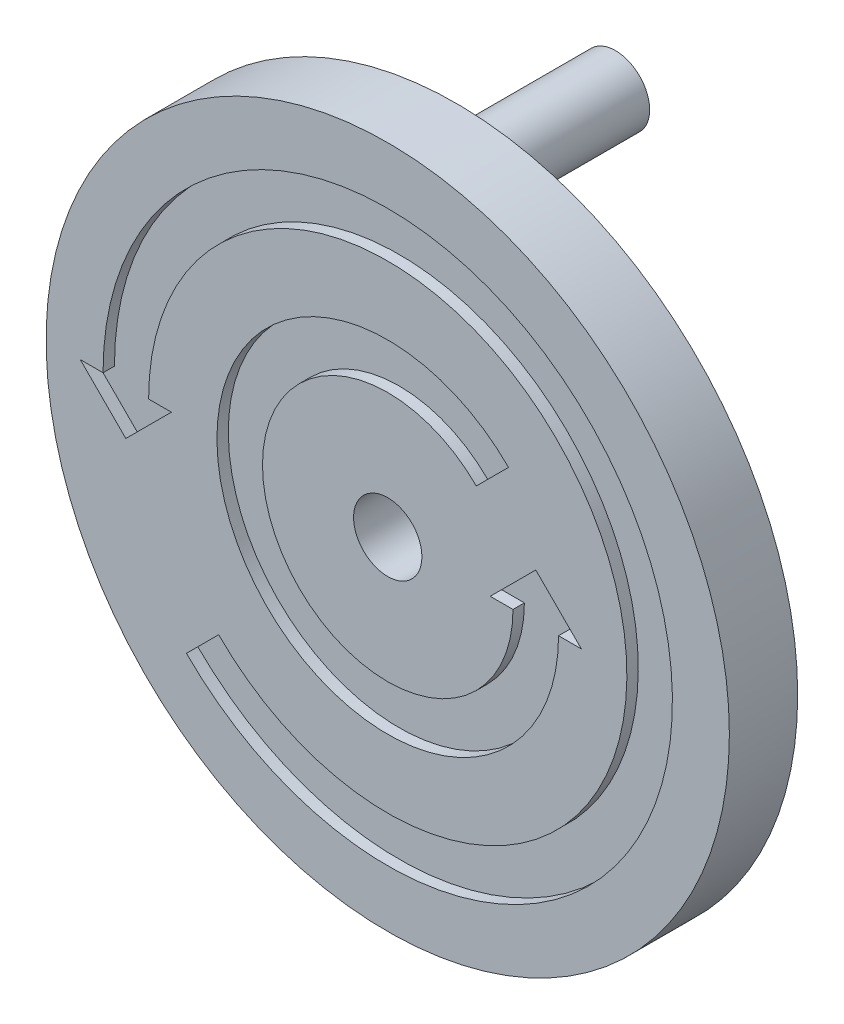
from build123d import *

# Parameters (mm, degrees)
CROQUIS1_R              = 15
CROQUIS1_R_2            = 1.5
SALIENTE_EXTRUIR1_DEPTH = 3
SALIENTE_EXTRUIR2_START = -10
CROQUIS2_R              = 1.5
SALIENTE_EXTRUIR2_DEPTH = 10
CORTAR_EXTRUIR1_DEPTH   = 0.5


with BuildPart() as part:
    # Croquis1 → Saliente-Extruir1 (new body)
    with BuildSketch(Plane.XY):
        Circle(CROQUIS1_R)
        with Locations((0, 12)):
            Circle(CROQUIS1_R_2, mode=Mode.SUBTRACT)
        with Locations((0, -12)):
            Circle(CROQUIS1_R_2, mode=Mode.SUBTRACT)
        Circle(CROQUIS1_R_2, mode=Mode.SUBTRACT)
    extrude(amount=SALIENTE_EXTRUIR1_DEPTH)

    # Croquis2 → Saliente-Extruir2 (add)
    with BuildSketch(Plane.XY.offset(3).offset(SALIENTE_EXTRUIR2_START)):
        with Locations((0, -12)):
            Circle(CROQUIS2_R)
        with Locations((0, 12)):
            Circle(CROQUIS2_R)
    extrude(amount=SALIENTE_EXTRUIR2_DEPTH)

    # Croquis3 → Cortar-Extruir1 (cut)
    with BuildSketch(Plane.XY.offset(3)):
        with BuildLine():
            Line((-7.424621202, -7.424621202), (-8.838834765, -8.838834765))
            ThreePointArc((-8.838834765, -8.838834765), (11.548494156, 4.783542905), (-12.5, 0))
            Line((-12.5, 0), (-13.5, 0))
            Line((-13.5, 0), (-11.5, -2))
            Line((-11.5, -2), (-9.5, 0))
            Line((-9.5, 0), (-10.5, 0))
            ThreePointArc((-10.5, 0), (9.700735091, 4.01817604), (-7.424621202, -7.424621202))
        make_face()
        with BuildLine():
            Line((5.5, 0), (4.5, 0))
            Line((4.5, 0), (6.5, 2))
            Line((6.5, 2), (8.5, 0))
            Line((8.5, 0), (7.5, 0))
            ThreePointArc((7.5, 0), (-6.929096494, -2.870125743), (5.303300859, 5.303300859))
            Line((5.303300859, 5.303300859), (3.889087297, 3.889087297))
            ThreePointArc((3.889087297, 3.889087297), (-5.081337429, -2.104758878), (5.5, 0))
        make_face()
    extrude(amount=-CORTAR_EXTRUIR1_DEPTH, mode=Mode.SUBTRACT)


solid = part.part
